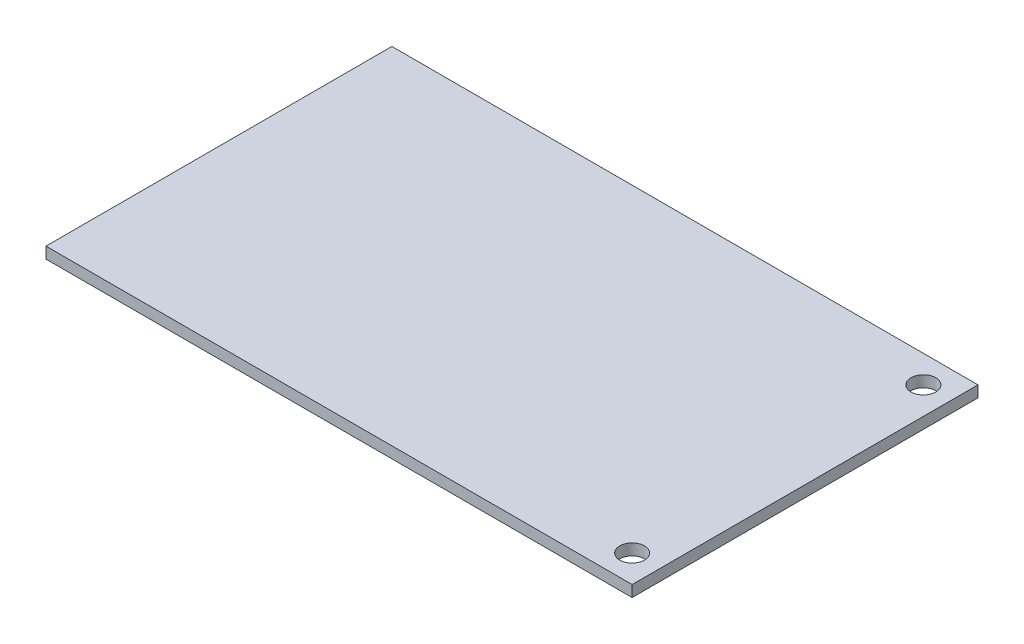
from build123d import *

# Parameters (mm, degrees)
SKETCH1_W           = 81.788
SKETCH1_H           = 48.26
SKETCH1_R           = 1.7272
BOSS_EXTRUDE1_DEPTH = 1.5748


with BuildPart() as part:
    # Sketch1 → Boss-Extrude1 (new body)
    with BuildSketch(Plane(origin=(0, 0, 0), x_dir=(1, 0, 0), z_dir=(0, 1, 0))):
        Rectangle(SKETCH1_W, SKETCH1_H)
        with Locations(Location((37.084, 20.32, 0), (0, 0, 270))):
            Circle(SKETCH1_R, mode=Mode.SUBTRACT)
        with Locations(Location((37.084, -20.32, 0), (0, 0, 90))):
            Circle(SKETCH1_R, mode=Mode.SUBTRACT)
    extrude(amount=BOSS_EXTRUDE1_DEPTH)


solid = part.part
